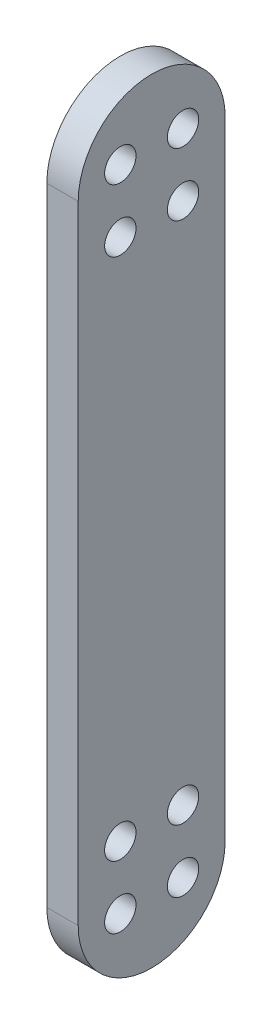
from build123d import *

# Parameters (mm, degrees)
RESSALTO_EXTRUS_O1_DEPTH = 40
ESBO_O2_R                = 5
CORTE_EXTRUS_O1_DEPTH    = 82.240384046
RESSALTO_EXTRUS_O2_START = 5
ESBO_O3_W                = 23.430524854
ESBO_O3_H                = 33.697961809
RESSALTO_EXTRUS_O2_DEPTH = 5
ESBO_O4_W                = 80.158201918
ESBO_O4_H                = 76.08775654
CORTE_EXTRUS_O2_DEPTH    = 50


with BuildPart() as part:
    # Esboço1 → Ressalto-extrusão1 (new body)
    with BuildSketch(Plane.XY):
        Polygon((0, 0), (0, 50), (10, 50), (10, 10), (40, 10), (40, 50), (50, 50), (50, 0), align=None)
    extrude(amount=RESSALTO_EXTRUS_O1_DEPTH)

    # Esboço2 → Corte-extrusão1 (cut, through all)
    with BuildSketch(Plane.ZY):
        with Locations((20, 33.697961809)):
            Circle(ESBO_O2_R)
    extrude(amount=-CORTE_EXTRUS_O1_DEPTH, mode=Mode.SUBTRACT)

    # Esboço3 → Ressalto-extrusão2 (add)
    # profile 1 of 9: a face of its own
    with BuildSketch(Plane.ZY.offset(RESSALTO_EXTRUS_O2_START)):
        with BuildLine():
            Line((31.715262427, 50), (8.284737573, 50))
            Line((8.284737573, 50), (8.284737573, 33.697961809))
            ThreePointArc((8.284737573, 33.697961809), (20, 21.982699383), (31.715262427, 33.697961809))
            Line((31.715262427, 33.697961809), (31.715262427, 50))
        make_face()
        with BuildLine():
            ThreePointArc((27.5, 41.982699383), (26.767766953, 40.21493243), (25, 39.482699383))
            Line((25, 39.482699383), (25, 34.482699383))
            ThreePointArc((25, 34.482699383), (26.767766953, 33.750466336), (27.5, 31.982699383))
            ThreePointArc((27.5, 31.982699383), (26.070626565, 29.723549375), (23.416992993, 30.047734572))
            ThreePointArc((23.416992993, 30.047734572), (20, 28.697961809), (16.583007007, 30.047734572))
            ThreePointArc((16.583007007, 30.047734572), (12.645492405, 31.142286397), (15, 34.482699383))
            Line((15, 34.482699383), (15, 39.482699383))
            ThreePointArc((15, 39.482699383), (13.232233047, 43.750466336), (17.5, 41.982699383))
            Line((17.5, 41.982699383), (22.5, 41.982699383))
            ThreePointArc((22.5, 41.982699383), (25, 44.482699383), (27.5, 41.982699383))
        make_face(mode=Mode.SUBTRACT)
    # profile 2 of 9: a face of its own
    with BuildSketch(Plane.ZY.offset(RESSALTO_EXTRUS_O2_START)):
        with BuildLine():
            Line((25, 34.482699383), (25, 39.482699383))
            ThreePointArc((25, 39.482699383), (23.232233047, 40.21493243), (22.5, 41.982699383))
            Line((22.5, 41.982699383), (17.5, 41.982699383))
            ThreePointArc((17.5, 41.982699383), (16.767766953, 40.21493243), (15, 39.482699383))
            Line((15, 39.482699383), (15, 34.482699383))
            ThreePointArc((15, 34.482699383), (15.030924245, 34.482508113), (15.061843757, 34.481934335))
            ThreePointArc((15.061843757, 34.481934335), (20, 38.697961809), (24.938156243, 34.481934335))
            ThreePointArc((24.938156243, 34.481934335), (24.969075755, 34.482508113), (25, 34.482699383))
        make_face()
    # profile 3 of 9: a face of its own
    with BuildSketch(Plane.ZY.offset(RESSALTO_EXTRUS_O2_START)):
        with BuildLine():
            ThreePointArc((22.5, 31.982699383), (23.210501552, 33.728464345), (24.938156243, 34.481934335))
            ThreePointArc((24.938156243, 34.481934335), (20, 38.697961809), (15.061843757, 34.481934335))
            ThreePointArc((15.061843757, 34.481934335), (16.789498448, 33.728464345), (17.5, 31.982699383))
            Line((17.5, 31.982699383), (22.5, 31.982699383))
        make_face()
    # profile 4 of 9: a face of its own
    with BuildSketch(Plane.ZY.offset(RESSALTO_EXTRUS_O2_START)):
        with BuildLine():
            ThreePointArc((16.583007007, 30.047734572), (20, 28.697961809), (23.416992993, 30.047734572))
            ThreePointArc((23.416992993, 30.047734572), (22.740849992, 30.912072818), (22.5, 31.982699383))
            Line((22.5, 31.982699383), (17.5, 31.982699383))
            ThreePointArc((17.5, 31.982699383), (17.259150008, 30.912072818), (16.583007007, 30.047734572))
        make_face()
    # profile 5 of 9: a face of its own
    with BuildSketch(Plane.ZY.offset(RESSALTO_EXTRUS_O2_START)):
        with BuildLine():
            ThreePointArc((22.5, 31.982699383), (23.210501552, 33.728464345), (24.938156243, 34.481934335))
            ThreePointArc((24.938156243, 34.481934335), (20, 38.697961809), (15.061843757, 34.481934335))
            ThreePointArc((15.061843757, 34.481934335), (16.789498448, 33.728464345), (17.5, 31.982699383))
            Line((17.5, 31.982699383), (22.5, 31.982699383))
        make_face()
    # profile 6 of 9: a face of its own
    with BuildSketch(Plane.ZY.offset(RESSALTO_EXTRUS_O2_START)):
        with BuildLine():
            ThreePointArc((16.583007007, 30.047734572), (20, 28.697961809), (23.416992993, 30.047734572))
            ThreePointArc((23.416992993, 30.047734572), (22.740849992, 30.912072818), (22.5, 31.982699383))
            Line((22.5, 31.982699383), (17.5, 31.982699383))
            ThreePointArc((17.5, 31.982699383), (17.259150008, 30.912072818), (16.583007007, 30.047734572))
        make_face()
    # profile 7 of 9: a face of its own
    with BuildSketch(Plane.ZY.offset(RESSALTO_EXTRUS_O2_START)):
        with Locations((20, 66.848980904)):
            Rectangle(ESBO_O3_W, ESBO_O3_H)
    # profile 8 of 9: a face of its own
    with BuildSketch(Plane.ZY.offset(RESSALTO_EXTRUS_O2_START)):
        with BuildLine():
            Line((8.284737573, 133.697961809), (8.284737573, 83.697961809))
            Line((8.284737573, 83.697961809), (31.715262427, 83.697961809))
            Line((31.715262427, 83.697961809), (31.715262427, 133.697961809))
            ThreePointArc((31.715262427, 133.697961809), (20, 145.413224236), (8.284737573, 133.697961809))
        make_face()
        with BuildLine():
            Line((22.5, 125.413224236), (17.5, 125.413224236))
            ThreePointArc((17.5, 125.413224236), (13.232233047, 123.645457283), (15, 127.913224236))
            Line((15, 127.913224236), (15, 132.913224236))
            ThreePointArc((15, 132.913224236), (13.232233047, 137.180991189), (17.5, 135.413224236))
            Line((17.5, 135.413224236), (22.5, 135.413224236))
            ThreePointArc((22.5, 135.413224236), (25, 137.913224236), (27.5, 135.413224236))
            ThreePointArc((27.5, 135.413224236), (26.767766953, 133.645457283), (25, 132.913224236))
            Line((25, 132.913224236), (25, 127.913224236))
            ThreePointArc((25, 127.913224236), (26.767766953, 127.180991189), (27.5, 125.413224236))
            ThreePointArc((27.5, 125.413224236), (25, 122.913224236), (22.5, 125.413224236))
        make_face(mode=Mode.SUBTRACT)
    # profile 9 of 9: a face of its own
    with BuildSketch(Plane.ZY.offset(RESSALTO_EXTRUS_O2_START)):
        with BuildLine():
            ThreePointArc((15, 127.913224236), (16.767766953, 127.180991189), (17.5, 125.413224236))
            Line((17.5, 125.413224236), (22.5, 125.413224236))
            ThreePointArc((22.5, 125.413224236), (23.232233047, 127.180991189), (25, 127.913224236))
            Line((25, 127.913224236), (25, 132.913224236))
            ThreePointArc((25, 132.913224236), (23.232233047, 133.645457283), (22.5, 135.413224236))
            Line((22.5, 135.413224236), (17.5, 135.413224236))
            ThreePointArc((17.5, 135.413224236), (16.767766953, 133.645457283), (15, 132.913224236))
            Line((15, 132.913224236), (15, 127.913224236))
        make_face()
    extrude(amount=-RESSALTO_EXTRUS_O2_DEPTH)

    # Esboço4 → Corte-extrusão2 (cut)
    with BuildSketch(Plane(origin=(50, 0, 0), x_dir=(0, 0, -1), z_dir=(1, 0, 0))):
        with Locations((-9.829245476, 29.588761993)):
            Rectangle(ESBO_O4_W, ESBO_O4_H)
    extrude(amount=-CORTE_EXTRUS_O2_DEPTH, mode=Mode.SUBTRACT)


solid = part.part
